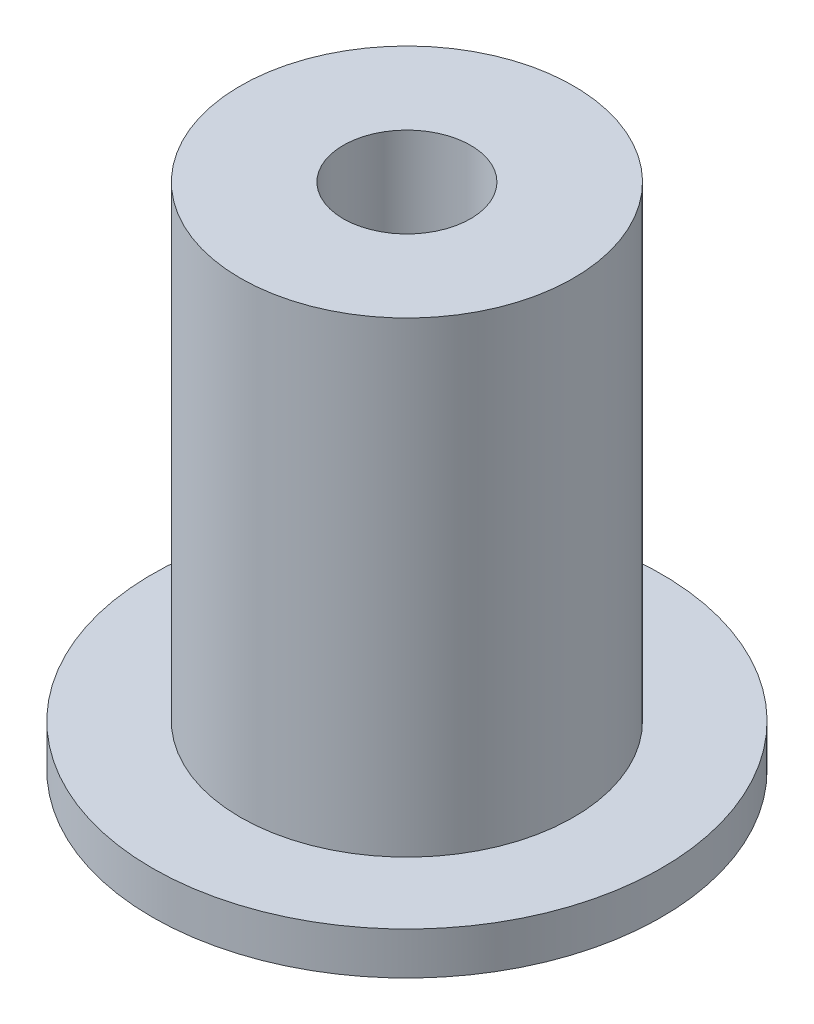
from build123d import *

# Parameters (mm, degrees)
SKIZZE1_R                       = 6
SKIZZE1_R_2                     = 1.5
AUFSATZ_LINEAR_AUSTRAGEN1_DEPTH = 1
SKIZZE2_R                       = 3.925
SKIZZE2_R_2                     = 1.5
AUFSATZ_LINEAR_AUSTRAGEN2_DEPTH = 11


with BuildPart() as part:
    # Skizze1 → Aufsatz-Linear austragen1 (new body)
    with BuildSketch(Plane(origin=(0, 0, 0), x_dir=(1, 0, 0), z_dir=(0, 1, 0))):
        with Locations(Location((0, 0, 0), (0, 0, 270))):
            Circle(SKIZZE1_R)
        with Locations(Location((0, 0, 0), (0, 0, 270))):
            Circle(SKIZZE1_R_2, mode=Mode.SUBTRACT)
    extrude(amount=AUFSATZ_LINEAR_AUSTRAGEN1_DEPTH)

    # Skizze2 → Aufsatz-Linear austragen2 (add)
    with BuildSketch(Plane(origin=(0, 1, 0), x_dir=(1, 0, 0), z_dir=(0, 1, 0))):
        with Locations(Location((0, 0, 0), (0, 0, 270))):
            Circle(SKIZZE2_R)
        with Locations(Location((0, 0, 0), (0, 0, 270))):
            Circle(SKIZZE2_R_2, mode=Mode.SUBTRACT)
    extrude(amount=AUFSATZ_LINEAR_AUSTRAGEN2_DEPTH)


solid = part.part
